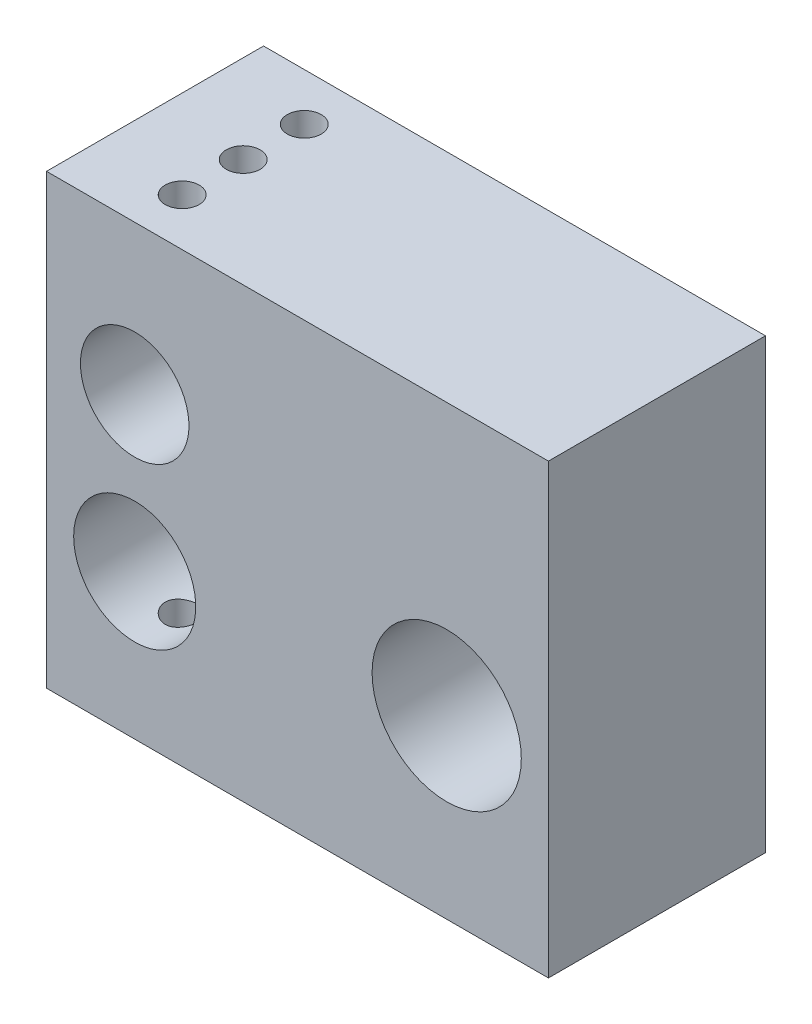
from build123d import *

# Parameters (mm, degrees)
ESQUISSE1_W             = 37
ESQUISSE1_H             = 16
BOSS_EXTRU_1_DEPTH      = 16.5
ESQUISSE3_R             = 5.5
ENL_V_MAT_EXTRU_2_DEPTH = 30.504236984
ESQUISSE14_R            = 4.5
ENL_V_MAT_EXTRU_3_DEPTH = 30.504236984
ESQUISSE15_R            = 4
ENL_V_MAT_EXTRU_4_DEPTH = 30.504236984
TROU_TARAUD_M34_REACH   = 40.668
TROU_TARAUD_M34_BORE_R  = 1.25
TROU_TARAUD_M35_REACH   = 40.668
TROU_TARAUD_M35_BORE_R  = 1.25
TROU_TARAUD_M36_REACH   = 41.444
TROU_TARAUD_M36_BORE_R  = 1.25


with BuildPart() as part:
    # Esquisse1 → Boss.-Extru.1 (new, symmetric)
    with BuildSketch(Plane(origin=(0, 0, 0), x_dir=(1, 0, 0), z_dir=(0, 1, 0))):
        Rectangle(ESQUISSE1_W, ESQUISSE1_H)
    extrude(amount=BOSS_EXTRU_1_DEPTH, both=True)

    # Esquisse3 → Enlèv. mat.-Extru.2 (cut, through all)
    with BuildSketch(Plane.XY.offset(8)):
        with Locations((11, -3.5)):
            Circle(ESQUISSE3_R)
    extrude(amount=-ENL_V_MAT_EXTRU_2_DEPTH, mode=Mode.SUBTRACT)

    # Esquisse14 → Enlèv. mat.-Extru.3 (cut, through all)
    with BuildSketch(Plane(origin=(0, 0, -8), x_dir=(-1, 0, 0), z_dir=(0, 0, -1))):
        with Locations((12, -5.8)):
            Circle(ESQUISSE14_R)
    extrude(amount=-ENL_V_MAT_EXTRU_3_DEPTH, mode=Mode.SUBTRACT)

    # Esquisse15 → Enlèv. mat.-Extru.4 (cut, through all)
    with BuildSketch(Plane(origin=(0, 0, -8), x_dir=(-1, 0, 0), z_dir=(0, 0, -1))):
        with Locations((12, 5.5)):
            Circle(ESQUISSE15_R)
    extrude(amount=-ENL_V_MAT_EXTRU_4_DEPTH, mode=Mode.SUBTRACT)

    # Trou taraudé M34 bore → Trou taraudé M34 (cut, up to next)
    with BuildSketch(Plane(origin=(0, 16.5, 0), x_dir=(1, 0, 0), z_dir=(0, 1, 0)), mode=Mode.PRIVATE) as trou_taraud_m34_sk1:
        with Locations((-12, -4.5)):
            Circle(TROU_TARAUD_M34_BORE_R)
    trou_taraud_m34_tool1 = extrude(trou_taraud_m34_sk1.sketch, amount=-TROU_TARAUD_M34_REACH, mode=Mode.PRIVATE) & part.part
    # Trou taraudé M34 bore → Trou taraudé M34 (cut, up to next)
    with BuildSketch(Plane(origin=(0, 16.5, 0), x_dir=(1, 0, 0), z_dir=(0, 1, 0)), mode=Mode.PRIVATE) as trou_taraud_m34_sk2:
        with Locations((-12, 4.5)):
            Circle(TROU_TARAUD_M34_BORE_R)
    trou_taraud_m34_tool2 = extrude(trou_taraud_m34_sk2.sketch, amount=-TROU_TARAUD_M34_REACH, mode=Mode.PRIVATE) & part.part
    add(trou_taraud_m34_tool1.solids().sort_by_distance((-12, 16.5, 4.5))[0], mode=Mode.SUBTRACT)
    add(trou_taraud_m34_tool2.solids().sort_by_distance((-12, 16.5, -4.5))[0], mode=Mode.SUBTRACT)

    # Trou taraudé M35 bore → Trou taraudé M35 (cut, up to next)
    with BuildSketch(Plane(origin=(0, -16.5, 0), x_dir=(-1, 0, 0), z_dir=(0, -1, 0)), mode=Mode.PRIVATE) as trou_taraud_m35_sk1:
        with Locations((12, -4.5)):
            Circle(TROU_TARAUD_M35_BORE_R)
    trou_taraud_m35_tool1 = extrude(trou_taraud_m35_sk1.sketch, amount=-TROU_TARAUD_M35_REACH, mode=Mode.PRIVATE) & part.part
    # Trou taraudé M35 bore → Trou taraudé M35 (cut, up to next)
    with BuildSketch(Plane(origin=(0, -16.5, 0), x_dir=(-1, 0, 0), z_dir=(0, -1, 0)), mode=Mode.PRIVATE) as trou_taraud_m35_sk2:
        with Locations((12, 4.5)):
            Circle(TROU_TARAUD_M35_BORE_R)
    trou_taraud_m35_tool2 = extrude(trou_taraud_m35_sk2.sketch, amount=-TROU_TARAUD_M35_REACH, mode=Mode.PRIVATE) & part.part
    add(trou_taraud_m35_tool1.solids().sort_by_distance((-12, -16.5, 4.5))[0], mode=Mode.SUBTRACT)
    add(trou_taraud_m35_tool2.solids().sort_by_distance((-12, -16.5, -4.5))[0], mode=Mode.SUBTRACT)

    # Trou taraudé M36 bore → Trou taraudé M36 (cut, up to next)
    with BuildSketch(Plane(origin=(-1.446004376, 16.5, -0.30351444), x_dir=(-1, 0, 0), z_dir=(0, 1, 0)), mode=Mode.PRIVATE) as trou_taraud_m36_sk1:
        with Locations((10.553995624, 0.30351444)):
            Circle(TROU_TARAUD_M36_BORE_R)
    trou_taraud_m36_tool1 = extrude(trou_taraud_m36_sk1.sketch, amount=-TROU_TARAUD_M36_REACH, mode=Mode.PRIVATE) & part.part
    add(trou_taraud_m36_tool1.solids().sort_by_distance((-12, 16.5, 0))[0], mode=Mode.SUBTRACT)


solid = part.part
